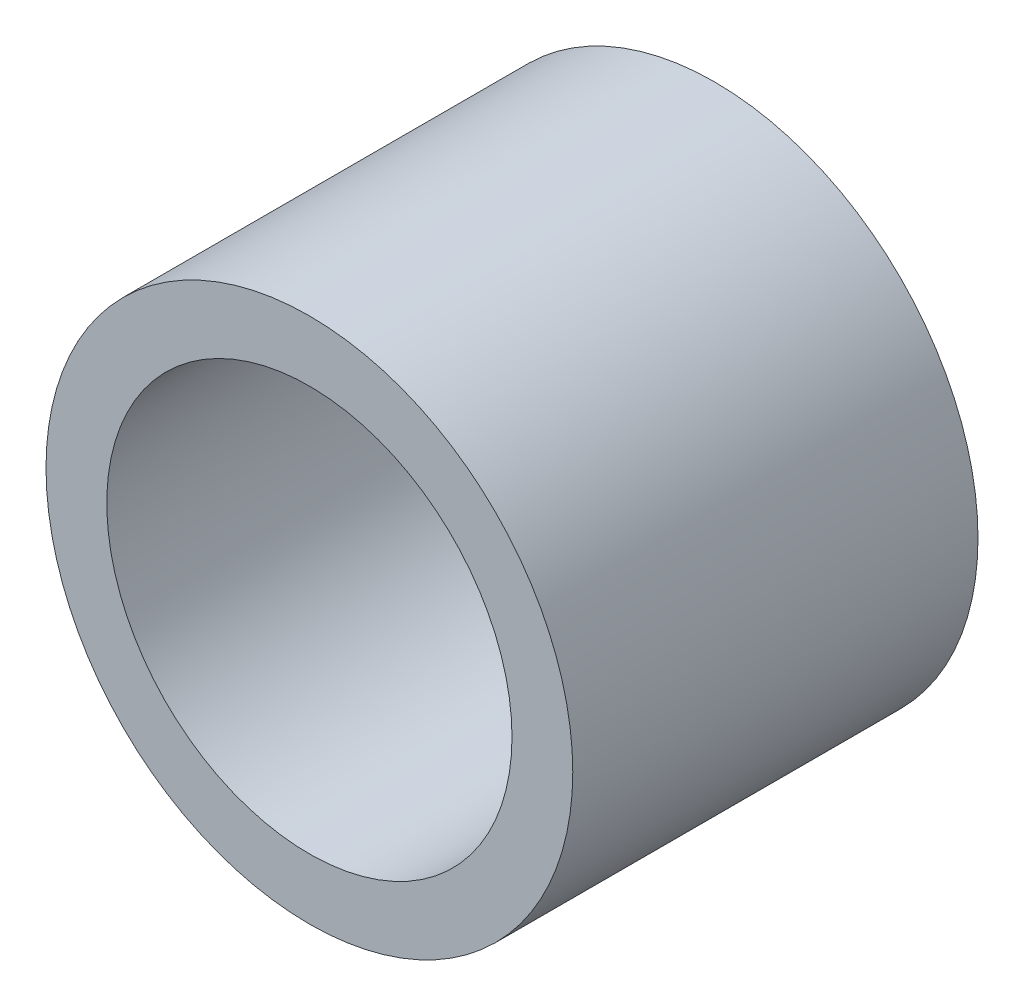
from build123d import *

# Parameters (mm, degrees)
SKETCH1_R      = 13
SKETCH1_R_2    = 10
EXTRUDE1_DEPTH = 10


with BuildPart() as part:
    # Sketch1 → Extrude1 (new, symmetric)
    with BuildSketch(Plane.XY):
        Circle(SKETCH1_R)
        Circle(SKETCH1_R_2, mode=Mode.SUBTRACT)
    extrude(amount=EXTRUDE1_DEPTH, both=True)


solid = part.part
